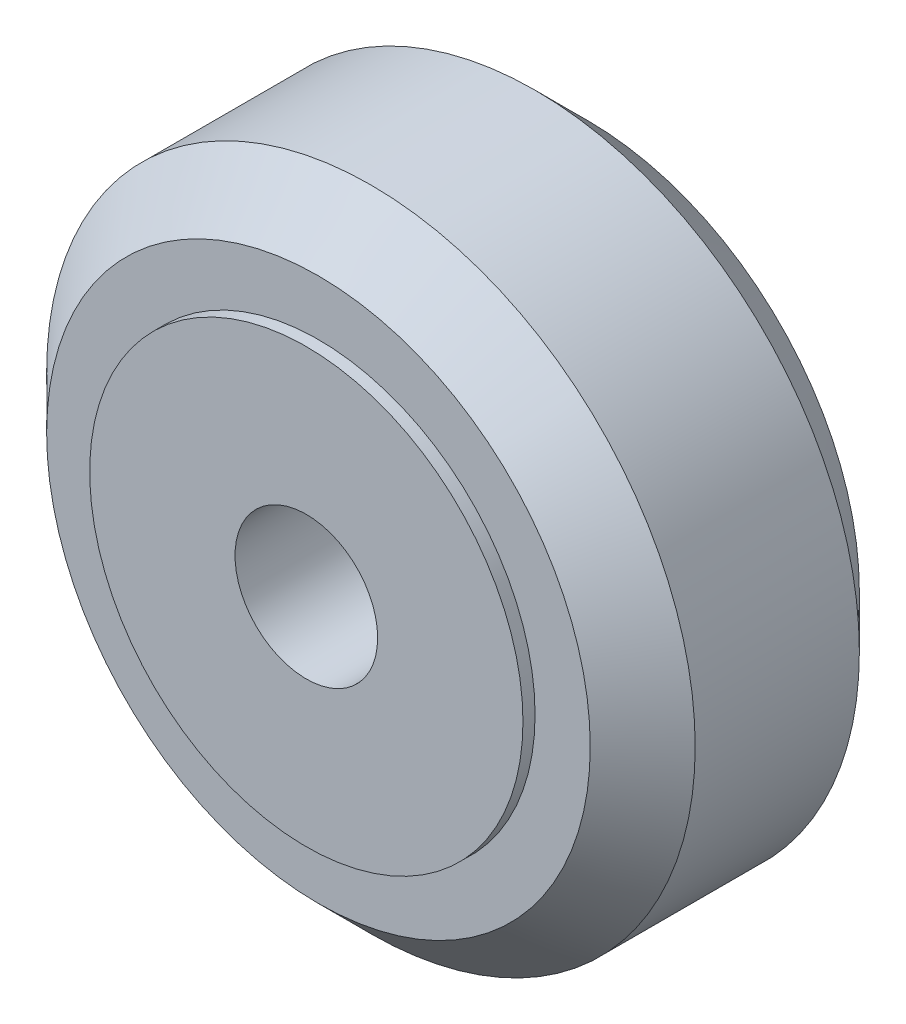
from build123d import *


with BuildPart() as part:
    # Sketch2 → Revolve1 (revolve)
    with BuildSketch(Plane(origin=(0, 0, 0), x_dir=(0, 0, -1), z_dir=(1, 0, 0)), mode=Mode.PRIVATE) as revolve1_sk:
        Polygon((-5.45, 2.65), (5.45, 2.65), (5.45, 8.05), (5, 8.05), (5, 10.1), (3.05, 12.05), (-3.05, 12.05), (-5, 10.1), (-5, 8.05), (-5.45, 8.05), align=None)
    revolve(revolve1_sk.sketch.rotate(Axis((0, 0, 10.445833333), (0, 0, -1)), 90), axis=Axis((0, 0, 10.445833333), (0, 0, -1)))


solid = part.part
